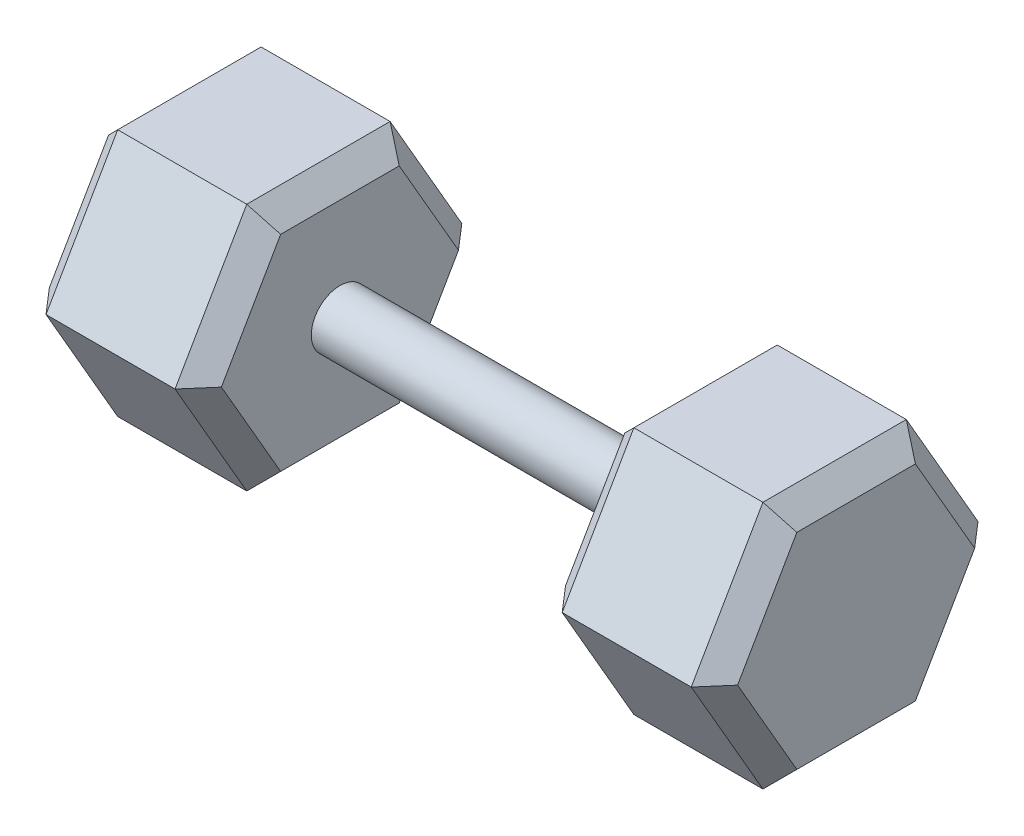
from build123d import *

# Parameters (mm, degrees)
BASE_EXTRUDE_DEPTH  = 76.2
CHAMFER1_SIZE       = 9.525
SKETCH2_R           = 12.691316964
BOSS_EXTRUDE1_DEPTH = 76.2


with BuildPart() as part:
    # Sketch1 → Base-Extrude (new body)
    with BuildSketch(Plane(origin=(0, 0, 0), x_dir=(0, 0, -1), z_dir=(1, 0, 0))):
        Polygon((63.5, 0), (31.75, 54.99261314), (-31.75, 54.99261314), (-63.5, 0), (-31.75, -54.99261314), (31.75, -54.99261314), align=None)
    extrude(amount=BASE_EXTRUDE_DEPTH)

    # Chamfer1
    chamfer1_edges = [part.edges().sort_by_distance(p)[0] for p in [
        (76.2, 54.99261314, 0),
        (76.2, 27.49630657, 47.625),
        (76.2, -27.49630657, 47.625),
        (76.2, -54.99261314, 0),
        (76.2, -27.49630657, -47.625),
        (0, -54.99261314, 0),
        (0, -27.49630657, 47.625),
        (0, 27.49630657, 47.625),
        (76.2, 27.49630657, -47.625),
        (0, 54.99261314, 0),
        (0, 27.49630657, -47.625),
        (0, -27.49630657, -47.625),
    ]]
    chamfer(chamfer1_edges, length=CHAMFER1_SIZE)

    # Sketch2 → Boss-Extrude1 (add)
    with BuildSketch(Plane(origin=(76.2, 0, 0), x_dir=(0, 0, -1), z_dir=(1, 0, 0))):
        with Locations(Location((0, 0, 0), (0, 0, 180))):
            Circle(SKETCH2_R)
    extrude(amount=BOSS_EXTRUDE1_DEPTH)

    # Mirror All1: part across plane


with BuildPart() as part_1:
    add(part.part)
    add(part.part.mirror(Plane(origin=(152.4, 0, 0), x_dir=(0, 0, 1), z_dir=(1, 0, 0))))


solid = part_1.part
